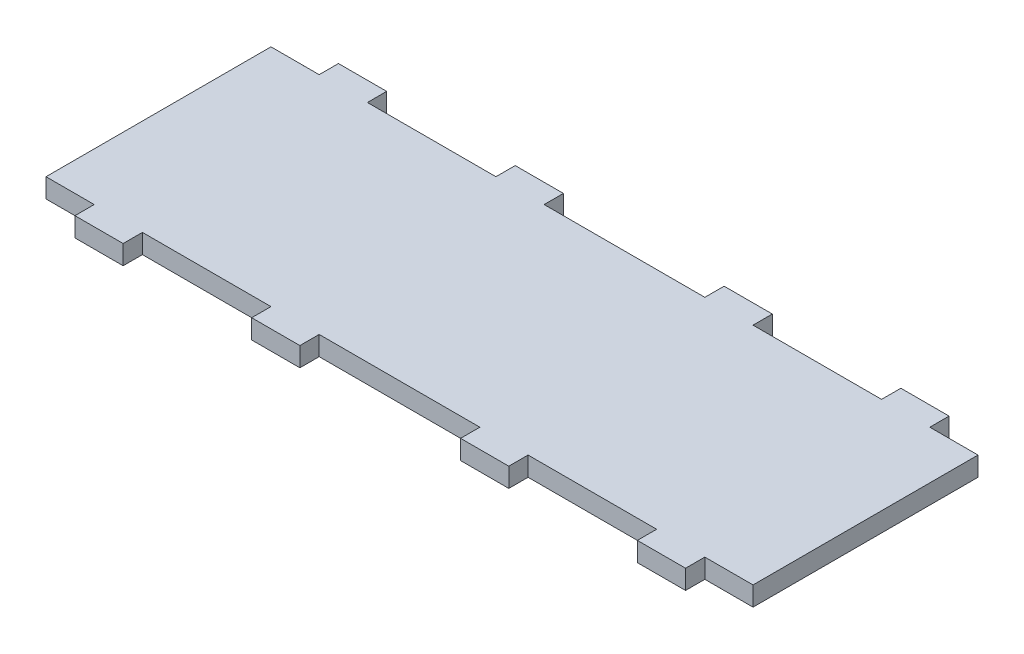
from build123d import *

# Parameters (mm, degrees)
BOSS_EXTRUDE1_DEPTH = 6


with BuildPart() as part:
    # Sketch1 → Boss-Extrude1 (new body)
    with BuildSketch(Plane(origin=(0, 0, 0), x_dir=(1, 0, 0), z_dir=(0, 1, 0))):
        Polygon((-160.386748432, 70), (-145.386748432, 70), (-145.386748432, 0), (-160.386748432, 0), (-160.386748432, -6), (-175.386748432, -6), (-175.386748432, 0), (-215.386748432, 0), (-215.386748432, -6), (-230.386748432, -6), (-230.386748432, 0), (-280.386748432, 0), (-280.386748432, -6), (-295.386748432, -6), (-295.386748432, 0), (-335.386748432, 0), (-335.386748432, -6), (-350.386748432, -6), (-350.386748432, 0), (-365.386748432, 0), (-365.386748432, 70), (-350.386748432, 70), (-350.386748432, 76), (-335.386748432, 76), (-335.386748432, 70), (-295.386748432, 70), (-295.386748432, 76), (-280.386748432, 76), (-280.386748432, 70), (-230.386748432, 70), (-230.386748432, 76), (-215.386748432, 76), (-215.386748432, 70), (-175.386748432, 70), (-175.386748432, 76), (-160.386748432, 76), align=None)
    extrude(amount=BOSS_EXTRUDE1_DEPTH)


solid = part.part
